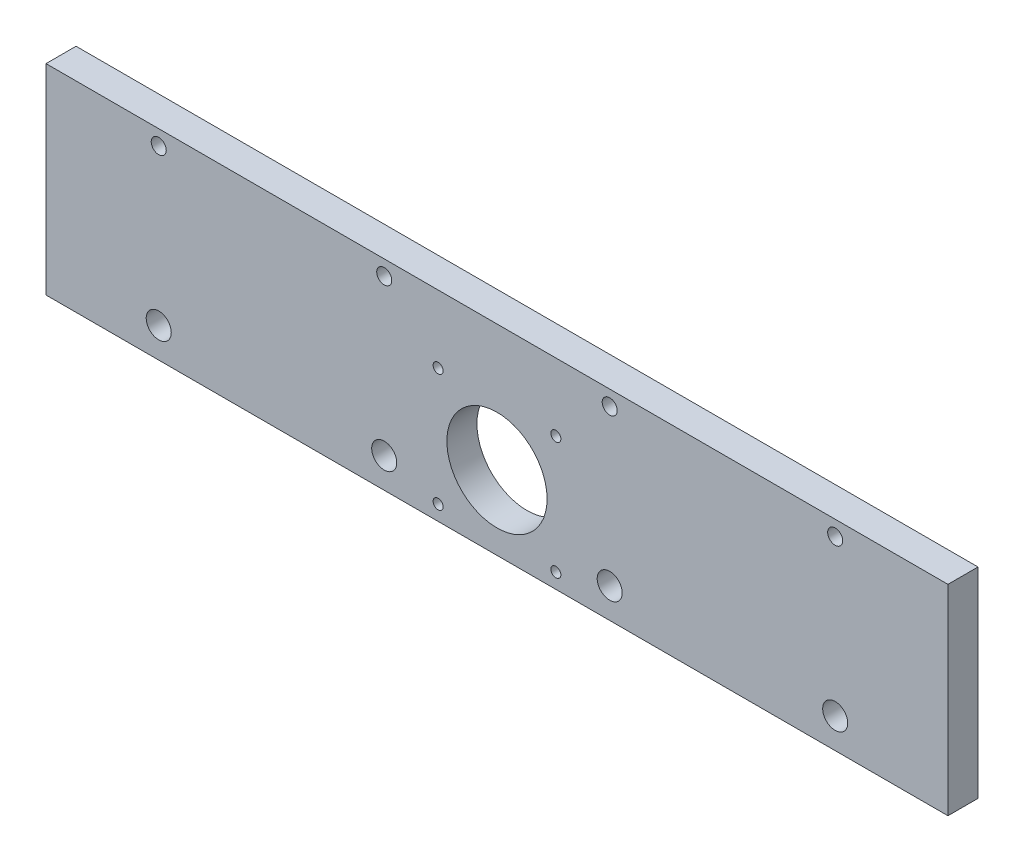
from build123d import *

# Parameters (mm, degrees)
SKETCH1_W           = 360
SKETCH1_H           = 80
BOSS_EXTRUDE1_DEPTH = 12
CUT_EXTRUDE1_REACH  = 186.781
SKETCH2_R           = 3
SKETCH2_R_2         = 5
LPATTERN1_COUNT     = 4
LPATTERN1_PITCH     = 90
CUT_EXTRUDE2_REACH  = 186.781
SKETCH3_R           = 20
CUT_EXTRUDE3_REACH  = 186.781
SKETCH4_R           = 2


with BuildPart() as part:
    # Sketch1 → Boss-Extrude1 (new body)
    with BuildSketch(Plane.XY):
        Rectangle(SKETCH1_W, SKETCH1_H)
    extrude(amount=BOSS_EXTRUDE1_DEPTH)

    # Sketch2 → Cut-Extrude1 (cut, up to next)
    with BuildSketch(Plane.XY.offset(12), mode=Mode.PRIVATE) as cut_extrude1_sk1:
        with Locations((135, 34)):
            Circle(SKETCH2_R)
    cut_extrude1_tool1 = extrude(cut_extrude1_sk1.sketch, amount=-CUT_EXTRUDE1_REACH, mode=Mode.PRIVATE) & part.part
    # Sketch2 → Cut-Extrude1 (cut, up to next)
    with BuildSketch(Plane.XY.offset(12), mode=Mode.PRIVATE) as cut_extrude1_sk2:
        with Locations((135, -28)):
            Circle(SKETCH2_R_2)
    cut_extrude1_tool2 = extrude(cut_extrude1_sk2.sketch, amount=-CUT_EXTRUDE1_REACH, mode=Mode.PRIVATE) & part.part
    cut_extrude1_1 = cut_extrude1_tool1.solids().sort_by_distance((135, 34, 12))[0]
    add(cut_extrude1_1, mode=Mode.SUBTRACT)
    cut_extrude1_2 = cut_extrude1_tool2.solids().sort_by_distance((135, -28, 12))[0]
    add(cut_extrude1_2, mode=Mode.SUBTRACT)
    cut_extrude1 = cut_extrude1_1 + cut_extrude1_2  # Cut-Extrude1 as one shape, for the pattern or mirror that repeats it

    # LPattern1: Cut-Extrude1 ×4
    with Locations(*[(-i * LPATTERN1_PITCH, 0, 0) for i in range(1, LPATTERN1_COUNT)]):
        add(cut_extrude1, mode=Mode.SUBTRACT)

    # Sketch3 → Cut-Extrude2 (cut, up to next)
    with BuildSketch(Plane.XY.offset(12), mode=Mode.PRIVATE) as cut_extrude2_sk1:
        with Locations((0, -10.5)):
            Circle(SKETCH3_R)
    cut_extrude2_tool1 = extrude(cut_extrude2_sk1.sketch, amount=-CUT_EXTRUDE2_REACH, mode=Mode.PRIVATE) & part.part
    add(cut_extrude2_tool1.solids().sort_by_distance((0, -10.5, 12))[0], mode=Mode.SUBTRACT)

    # Sketch4 → Cut-Extrude3 (cut, up to next)
    with BuildSketch(Plane.XY.offset(12), mode=Mode.PRIVATE) as cut_extrude3_sk1:
        with Locations((-23.5, 13)):
            Circle(SKETCH4_R)
    cut_extrude3_tool1 = extrude(cut_extrude3_sk1.sketch, amount=-CUT_EXTRUDE3_REACH, mode=Mode.PRIVATE) & part.part
    # Sketch4 → Cut-Extrude3 (cut, up to next)
    with BuildSketch(Plane.XY.offset(12), mode=Mode.PRIVATE) as cut_extrude3_sk2:
        with Locations((-23.5, -34)):
            Circle(SKETCH4_R)
    cut_extrude3_tool2 = extrude(cut_extrude3_sk2.sketch, amount=-CUT_EXTRUDE3_REACH, mode=Mode.PRIVATE) & part.part
    cut_extrude3_1 = cut_extrude3_tool1.solids().sort_by_distance((-23.5, 13, 12))[0]
    add(cut_extrude3_1, mode=Mode.SUBTRACT)
    cut_extrude3_2 = cut_extrude3_tool2.solids().sort_by_distance((-23.5, -34, 12))[0]
    add(cut_extrude3_2, mode=Mode.SUBTRACT)
    cut_extrude3 = cut_extrude3_1 + cut_extrude3_2  # Cut-Extrude3 as one shape, for the pattern or mirror that repeats it

    # Mirror2: Cut-Extrude3 across plane
    add(cut_extrude3.mirror(Plane(origin=(0, 0, 0), x_dir=(0, 0, 1), z_dir=(1, 0, 0))), mode=Mode.SUBTRACT)


solid = part.part
